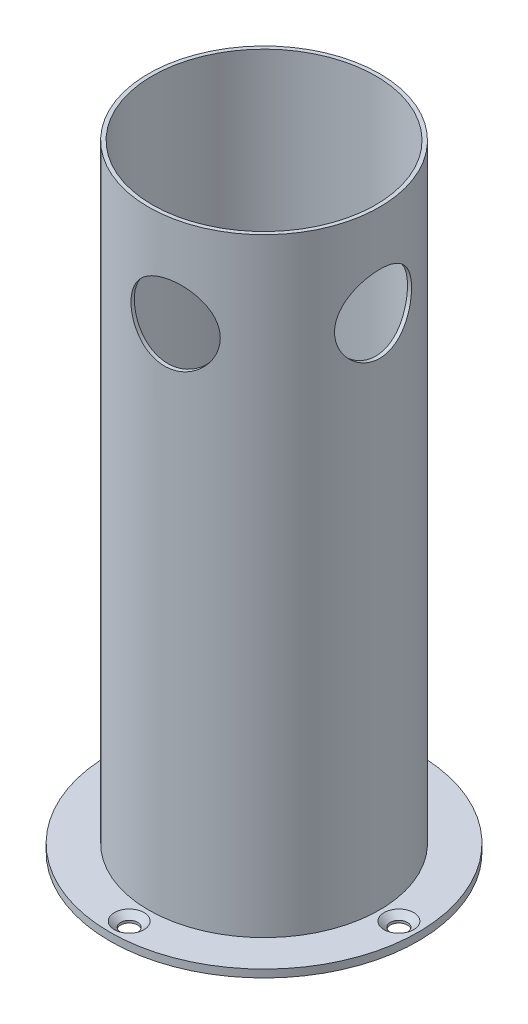
from build123d import *

# Parameters (mm, degrees)
SKETCH1_R                                  = 38.1
SKETCH1_R_2                                = 36.83
BOSS_EXTRUDE1_DEPTH                        = 203.2
SKETCH2_R                                  = 12.7
CUT_EXTRUDE1_DEPTH                         = 211.222406037
CIRPATTERN2_COUNT                          = 2
CIRPATTERN2_ANGLE                          = 80
SKETCH5_R                                  = 50.8
SKETCH5_R_2                                = 38.1
BOSS_EXTRUDE2_DEPTH                        = 2.54
CSK_FOR_10_FLAT_HEAD_MACHINE_SCREW_2_COUNT = 2
CSK_FOR_10_FLAT_HEAD_MACHINE_SCREW_2_PITCH = 62.861792847
CIRPATTERN3_COUNT                          = 2


with BuildPart() as part:
    # Sketch1 → Boss-Extrude1 (new body)
    with BuildSketch(Plane(origin=(0, 0, 0), x_dir=(1, 0, 0), z_dir=(0, 1, 0))):
        with Locations(Location((0, 0, 0), (0, 0, 270))):
            Circle(SKETCH1_R)
        with Locations(Location((0, 0, 0), (0, 0, 270))):
            Circle(SKETCH1_R_2, mode=Mode.SUBTRACT)
    extrude(amount=BOSS_EXTRUDE1_DEPTH)

    # Sketch2 → Cut-Extrude1 (cut, through all)
    with BuildSketch(Plane(origin=(0, 0, 0), x_dir=(0, 0, -1), z_dir=(1, 0, 0))):
        with Locations(Location((0, 172.72, 0), (0, 0, 180))):
            Circle(SKETCH2_R)
    cut_extrude1 = extrude(amount=CUT_EXTRUDE1_DEPTH, mode=Mode.SUBTRACT)

    # CirPattern2: Cut-Extrude1 ×2 about axis
    cirpattern2_axis = Axis((0, 203.2, 0), (0, -1, 0))
    for i in range(1, CIRPATTERN2_COUNT):
        add(cut_extrude1.rotate(cirpattern2_axis, i * CIRPATTERN2_ANGLE / (CIRPATTERN2_COUNT - 1)), mode=Mode.SUBTRACT)

    # Sketch5 → Boss-Extrude2 (add)
    with BuildSketch(Plane(origin=(0, 0, 0), x_dir=(1, 0, 0), z_dir=(0, 1, 0))):
        with Locations(Location((0, 0, 0), (0, 0, 270))):
            Circle(SKETCH5_R)
        with Locations(Location((0, 0, 0), (0, 0, 270))):
            Circle(SKETCH5_R_2, mode=Mode.SUBTRACT)
    extrude(amount=BOSS_EXTRUDE2_DEPTH)

    # Sketch7 → CSK for #10 Flat Head Machine Screw (100)1 (revolve, cut)
    with BuildSketch(Plane(origin=(0, 2.54, -44.45), x_dir=(0, 0, 1), z_dir=(1, 0, 0))):
        Polygon((0, 0), (0, 2.54), (2.8067, 2.54), (2.8067, 1.747676712), (4.8895, 0), align=None)
    csk_for_10_flat_head_machine_screw_100 = revolve(axis=Axis((0, 8.89, -44.45), (0, -1, 0)), mode=Mode.SUBTRACT)

    # CSK for _10 Flat Head Machine Screw  2: CSK for #10 Flat Head Machine Screw (100)1 ×2
    with Locations(*[Vector(0.7071067811865476, 0, 0.7071067811865476) * (i * CSK_FOR_10_FLAT_HEAD_MACHINE_SCREW_2_PITCH) for i in range(1, CSK_FOR_10_FLAT_HEAD_MACHINE_SCREW_2_COUNT)]):
        add(csk_for_10_flat_head_machine_screw_100, mode=Mode.SUBTRACT)

    # CirPattern3: CSK for #10 Flat Head Machine Screw (100)1 ×2 about axis
    cirpattern3_axis = Axis((0, 0, 0), (0, 1, 0))
    for i in range(1, CIRPATTERN3_COUNT):
        add(csk_for_10_flat_head_machine_screw_100.rotate(cirpattern3_axis, i * 360 / CIRPATTERN3_COUNT), mode=Mode.SUBTRACT)

    # CirPattern3 copy 1 sketch → CirPattern3 copy 1 (revolve, cut)
    with BuildSketch(Plane(origin=(-44.45, 2.54, 0), x_dir=(0, 0, -1), z_dir=(-1, 0, 0))):
        Polygon((0, 0), (0, 2.54), (2.8067, 2.54), (2.8067, 1.747676712), (4.8895, 0), align=None)
    revolve(axis=Axis((-44.45, 8.89, 0), (0, -1, 0)), mode=Mode.SUBTRACT)


solid = part.part
